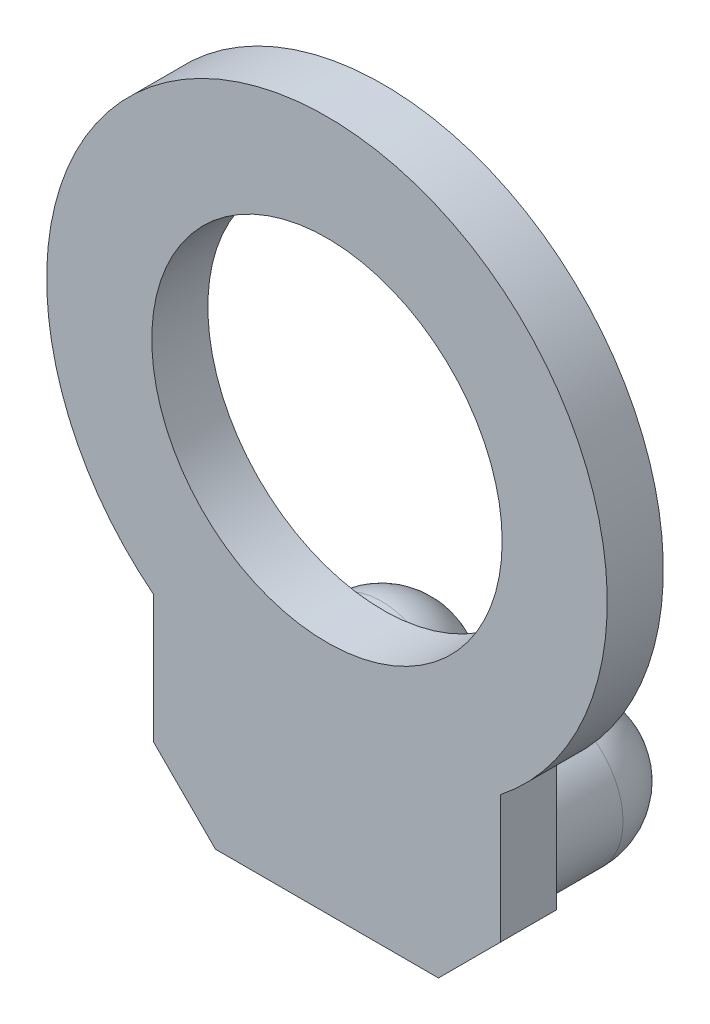
from build123d import *

# Parameters (mm, degrees)
SKETCH1_R           = 5
SKETCH1_R_2         = 2
BOSS_EXTRUDE1_DEPTH = 1.6
BOSS_EXTRUDE2_START = -6
SKETCH2_R           = 2
BOSS_EXTRUDE2_DEPTH = 6
FILLET1_R           = 2


with BuildPart() as part:
    # Sketch1 → Boss-Extrude1 (new body)
    with BuildSketch(Plane.XY):
        with BuildLine():
            Line((4.95, -9.932233047), (4.95, -6.284703653))
            ThreePointArc((4.95, -6.284703653), (0, 8), (-4.95, -6.284703653))
            Line((-4.95, -6.284703653), (-4.95, -9.932233047))
            Line((-4.95, -9.932233047), (-3.182233047, -11.7))
            Line((-3.182233047, -11.7), (3.182233047, -11.7))
            Line((3.182233047, -11.7), (4.95, -9.932233047))
        make_face()
        Circle(SKETCH1_R, mode=Mode.SUBTRACT)
        with Locations((2.45, -9.2)):
            Circle(SKETCH1_R_2, mode=Mode.SUBTRACT)
        with Locations((-2.45, -9.2)):
            Circle(SKETCH1_R_2, mode=Mode.SUBTRACT)
    extrude(amount=BOSS_EXTRUDE1_DEPTH)

    # Sketch2 → Boss-Extrude2 (add)
    with BuildSketch(Plane.XY.offset(1.6).offset(BOSS_EXTRUDE2_START)):
        with Locations((2.45, -9.2)):
            Circle(SKETCH2_R)
        with Locations((-2.45, -9.2)):
            Circle(SKETCH2_R)
    extrude(amount=BOSS_EXTRUDE2_DEPTH)

    # Fillet1
    fillet1_edges = [part.edges().sort_by_distance(p)[0] for p in [
        (-4.45, -9.2, -4.4),
        (0.45, -9.2, -4.4),
    ]]
    fillet(fillet1_edges, radius=FILLET1_R)


solid = part.part
